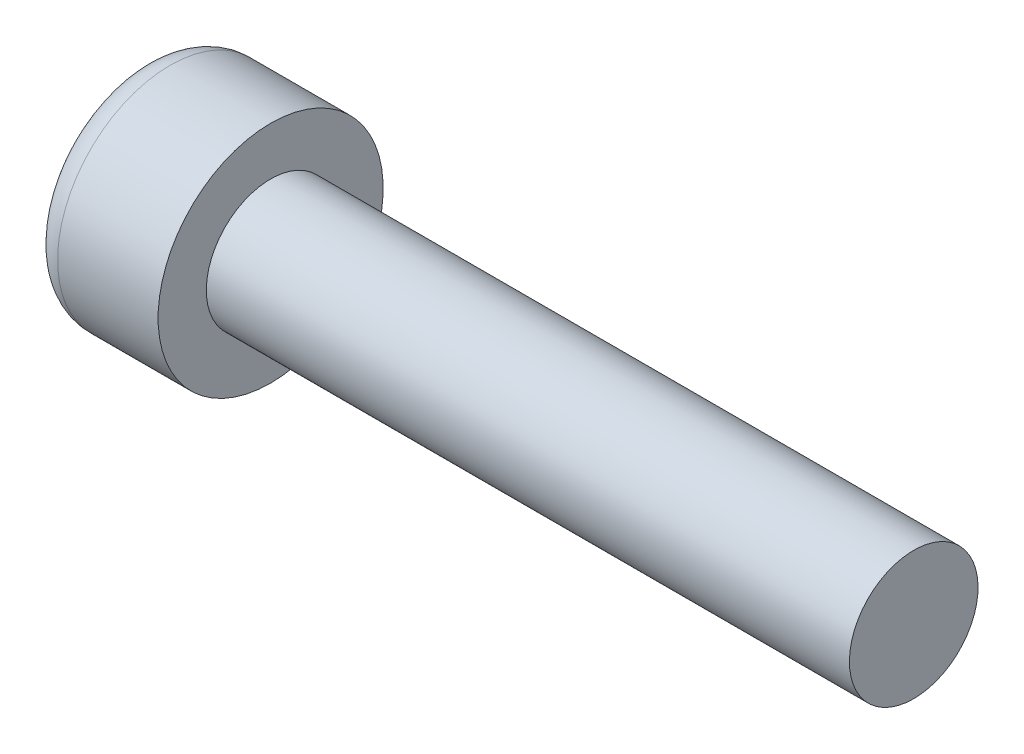
from build123d import *

# Parameters (mm, degrees)
CUT_EXTRUDE1_DEPTH = 2


with BuildPart() as part:
    # Sketch1 → Revolve1 (revolve)
    with BuildSketch(Plane.XY, mode=Mode.PRIVATE) as revolve1_sk:
        with BuildLine():
            Line((0, 0), (0, 2.625))
            ThreePointArc((0, 2.625), (0.256281566, 3.243718434), (0.875, 3.5))
            Line((0.875, 3.5), (4, 3.5))
            Line((4, 3.5), (4, 2))
            Line((4, 2), (24, 2))
            Line((24, 2), (24, 0))
            Line((24, 0), (0, 0))
        make_face()
    revolve(revolve1_sk.sketch.rotate(Axis((0, 0, 0), (1, 0, 0)), 180), axis=Axis((0, 0, 0), (1, 0, 0)))

    # Sketch2 → Cut-Extrude1 (cut)
    with BuildSketch(Plane.ZY):
        Polygon((0, 1.732050808), (-1.5, 0.866025404), (-1.5, -0.866025404), (0, -1.732050808), (1.5, -0.866025404), (1.5, 0.866025404), align=None)
    extrude(amount=-CUT_EXTRUDE1_DEPTH, mode=Mode.SUBTRACT)


solid = part.part
